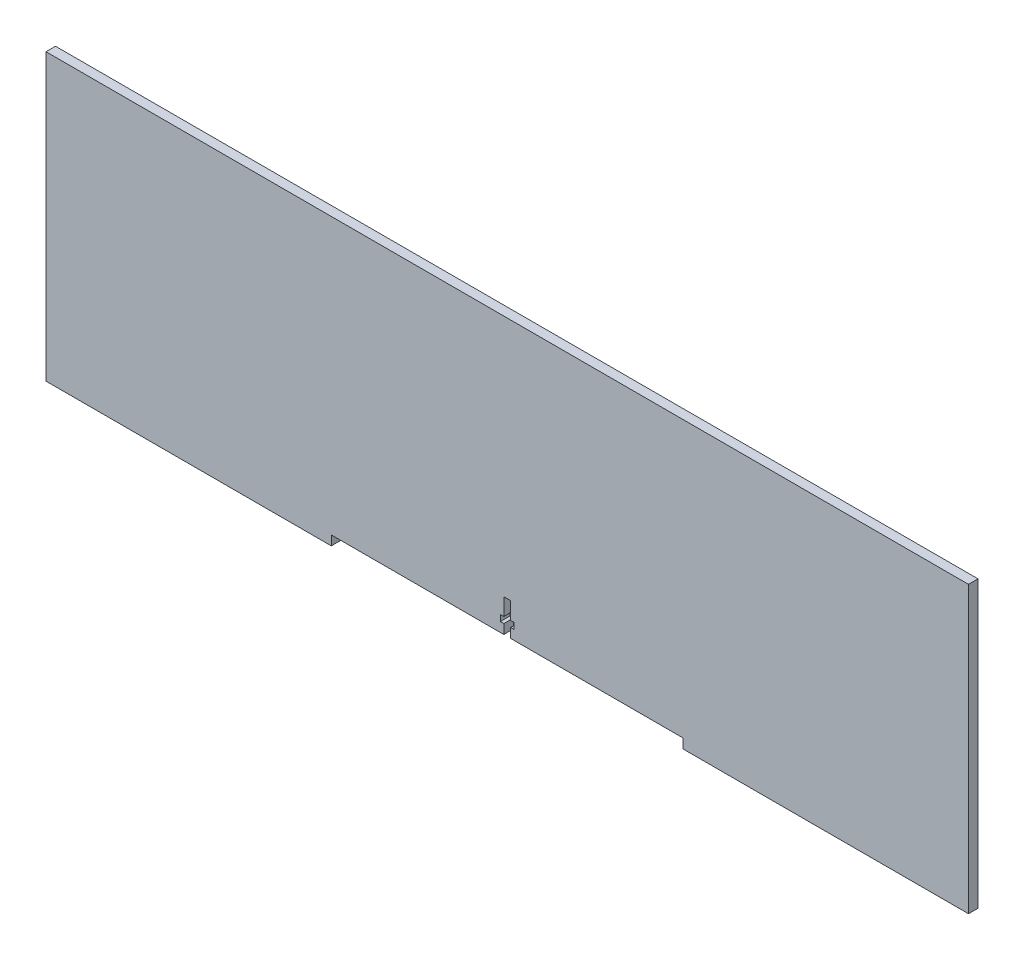
from build123d import *

# Parameters (mm, degrees)
SALIENTE_EXTRUIR1_DEPTH = 5
CROQUIS2_W              = 5
CROQUIS2_H              = 35
CORTAR_EXTRUIR1_DEPTH   = 5
CORTAR_EXTRUIR2_DEPTH   = 10
CORTAR_EXTRUIR3_DEPTH   = 10


with BuildPart() as part:
    # Croquis1 → Saliente-Extruir1 (new body)
    with BuildSketch(Plane.XY):
        Polygon((0, 145), (0, 0), (183.734642654, 0), (185, 0), (185, -5), (485, -5), (485, 0), (670, 0), (670, -5), (970, -5), (970, 0), (1155, 0), (1155, -5), (1455, -5), (1455, 0), (1640, 0), (1640, 145), align=None)
    extrude(amount=SALIENTE_EXTRUIR1_DEPTH)

    # Croquis2 → Cortar-Extruir1 (cut)
    with BuildSketch(Plane.XY.offset(5)):
        with Locations((1637.5, 108.75)):
            Rectangle(CROQUIS2_W, CROQUIS2_H)
        with Locations((1637.5, 36.25)):
            Rectangle(CROQUIS2_W, CROQUIS2_H)
        with Locations((2.5, 36.25)):
            Rectangle(CROQUIS2_W, CROQUIS2_H)
        with Locations((2.5, 108.75)):
            Rectangle(CROQUIS2_W, CROQUIS2_H)
    extrude(amount=-CORTAR_EXTRUIR1_DEPTH, mode=Mode.SUBTRACT)

    # Croquis3 → Cortar-Extruir2 (cut)
    with BuildSketch(Plane.XY.offset(5)):
        Polygon((579.3, 0), (575.7, 0), (575.7, 5), (573.9, 5), (573.9, 8.2), (575.7, 8.2), (575.7, 17.2), (579.3, 17.2), (579.3, 8.2), (581.1, 8.2), (581.1, 5), (579.3, 5), align=None)
        Polygon((1064.3, 8.2), (1064.3, 17.2), (1060.7, 17.2), (1060.7, 8.2), (1058.9, 8.2), (1058.9, 5), (1060.7, 5), (1060.7, 0), (1064.3, 0), (1064.3, 5), (1066.1, 5), (1066.1, 8.2), align=None)
    extrude(amount=-CORTAR_EXTRUIR2_DEPTH, mode=Mode.SUBTRACT)

    # Croquis4 → Cortar-Extruir3 (cut)
    with BuildSketch(Plane.XY.offset(5)):
        Polygon((820, -135.215134583), (820, -5), (820, 145), (1680.90531261, 145), (1680.90531261, -135.215134583), align=None)
        Polygon((-54.126179429, 245.627194546), (335, 145), (335, -5), (335, -117.531617176), (-54.126179429, -117.531617176), align=None)
    extrude(amount=-CORTAR_EXTRUIR3_DEPTH, mode=Mode.SUBTRACT)


solid = part.part
